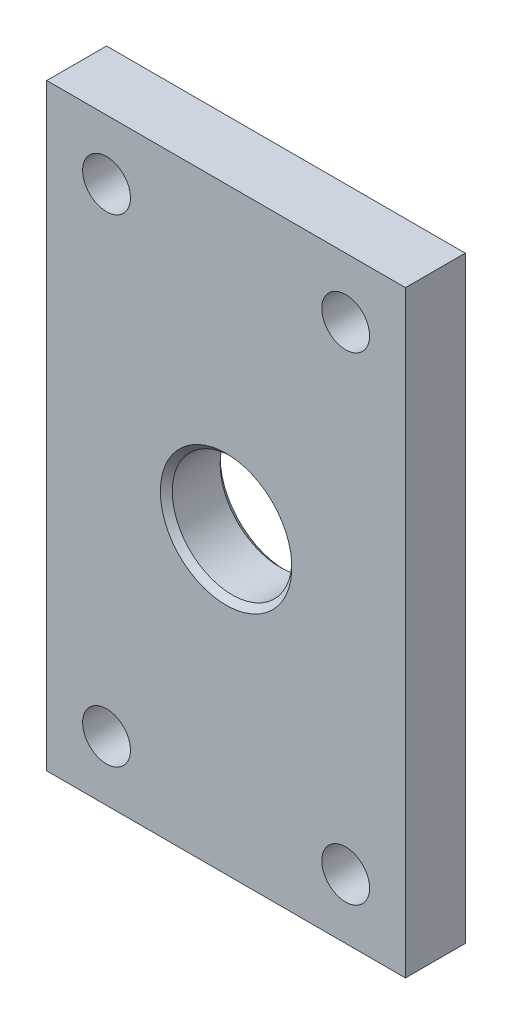
from build123d import *

# Parameters (mm, degrees)
SKETCH1_W           = 100
SKETCH1_H           = 60
BOSS_EXTRUDE1_DEPTH = 5
CUT_EXTRUDE2_START  = 5
SKETCH2_R           = 4
CUT_EXTRUDE2_DEPTH  = 64.523499554
CUT_EXTRUDE4_START  = 5
SKETCH3_R           = 10
CUT_EXTRUDE4_DEPTH  = 64.523499554
CHAMFER1_SIZE       = 1


with BuildPart() as part:
    # Sketch1 → Boss-Extrude1 (new, symmetric)
    with BuildSketch(Plane(origin=(0, 0, 0), x_dir=(0, 1, 0), z_dir=(0, 0, 1))):
        Rectangle(SKETCH1_W, SKETCH1_H)
    extrude(amount=BOSS_EXTRUDE1_DEPTH, both=True)

    # Sketch2 → Cut-Extrude2 (cut, through all)
    with BuildSketch(Plane(origin=(0, 0, 0), x_dir=(0, 1, 0), z_dir=(0, 0, 1)).offset(CUT_EXTRUDE2_START)):
        with Locations(Location((-40, -20, 0), (0, 0, 270))):
            Circle(SKETCH2_R)
        with Locations(Location((40, -20, 0), (0, 0, 270))):
            Circle(SKETCH2_R)
        with Locations(Location((-40, 20, 0), (0, 0, 270))):
            Circle(SKETCH2_R)
        with Locations(Location((40, 20, 0), (0, 0, 270))):
            Circle(SKETCH2_R)
    extrude(amount=-CUT_EXTRUDE2_DEPTH, mode=Mode.SUBTRACT)

    # Sketch3 → Cut-Extrude4 (cut, through all)
    with BuildSketch(Plane(origin=(0, 0, 0), x_dir=(0, 1, 0), z_dir=(0, 0, 1)).offset(CUT_EXTRUDE4_START)):
        with Locations(Location((0, 0, 0), (0, 0, 270))):
            Circle(SKETCH3_R)
    extrude(amount=-CUT_EXTRUDE4_DEPTH, mode=Mode.SUBTRACT)

    # Chamfer1
    chamfer1_edges = [part.edges().sort_by_distance(p)[0] for p in [
        (-10, 0, -5),
        (-10, 0, 5),
    ]]
    chamfer(chamfer1_edges, length=CHAMFER1_SIZE)


solid = part.part
